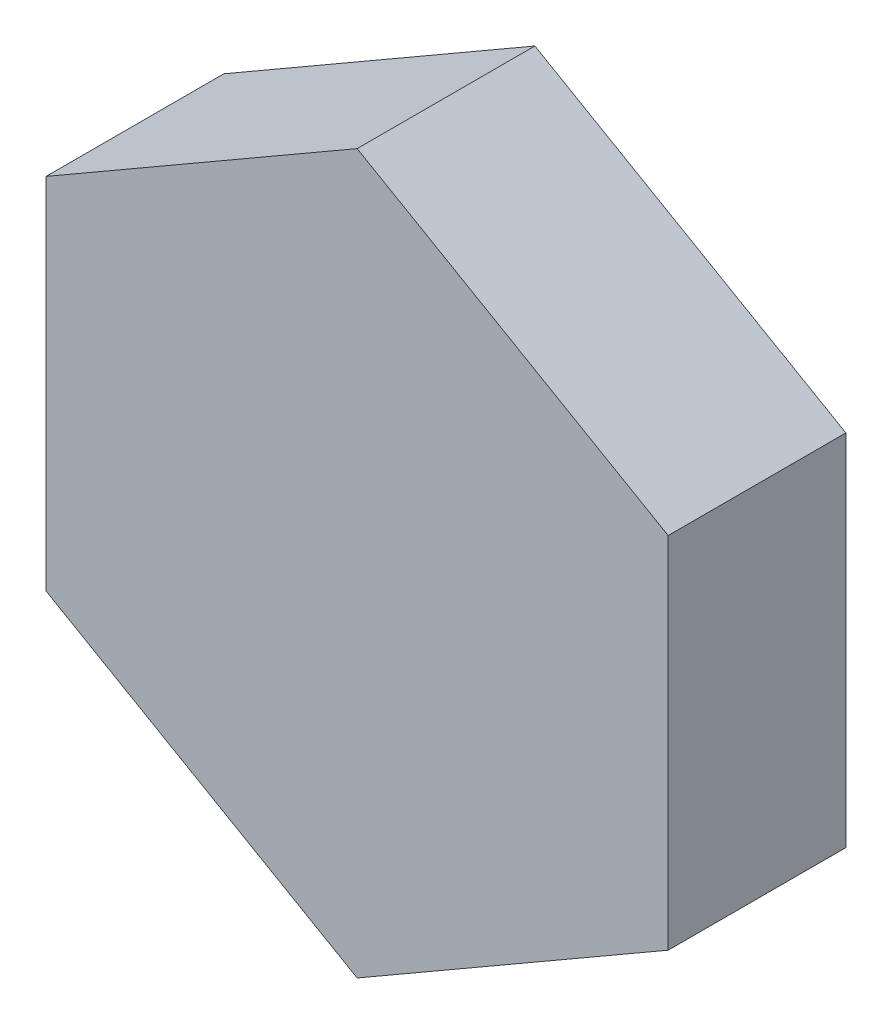
from build123d import *

# Parameters (mm, degrees)
BOSS_EXTRUDE1_DEPTH = 2


with BuildPart() as part:
    # Sketch1 → Boss-Extrude1 (new body)
    with BuildSketch(Plane.XY):
        Polygon((3.5, -2.020725942), (3.5, 2.020725942), (0, 4.041451884), (-3.5, 2.020725942), (-3.5, -2.020725942), (0, -4.041451884), align=None)
    extrude(amount=BOSS_EXTRUDE1_DEPTH)


solid = part.part
